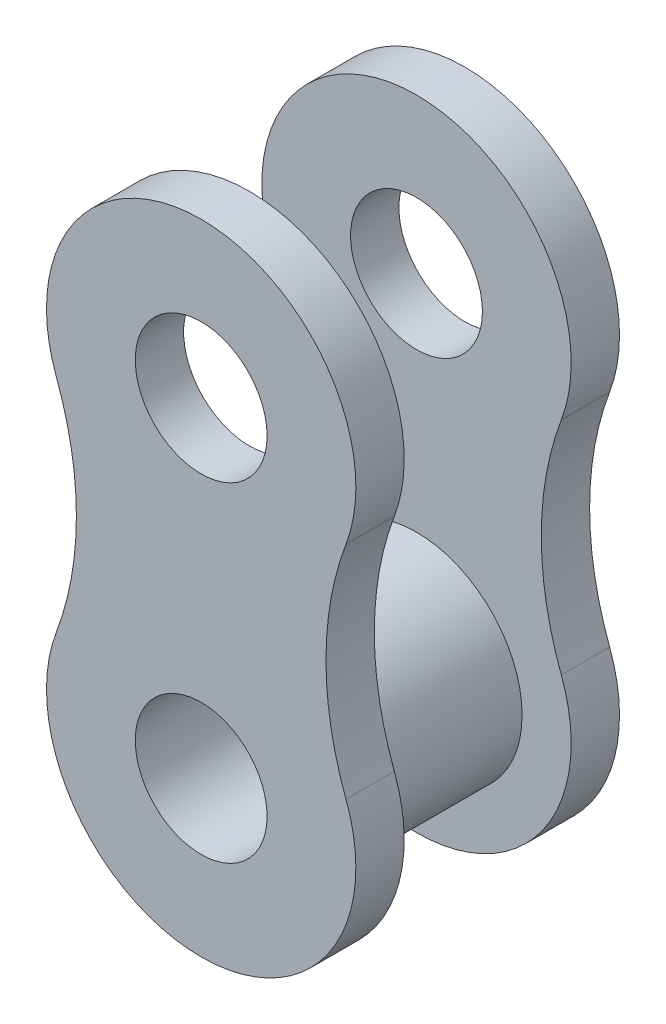
from build123d import *

# Parameters (mm, degrees)
SKETCH2_R           = 4.4704
SKETCH2_R_2         = 1.905
BOSS_EXTRUDE1_DEPTH = 1.397
SKETCH3_R           = 3.052127004
SKETCH3_R_2         = 1.905
BOSS_EXTRUDE2_DEPTH = 4.826


with BuildPart() as part:
    # Sketch2 → Boss-Extrude1 (new body)
    # profile 1 of 3: a face of its own
    with BuildSketch(Plane.XY):
        Circle(SKETCH2_R)
        Circle(SKETCH2_R_2, mode=Mode.SUBTRACT)
    # profile 2 of 3: a face of its own
    with BuildSketch(Plane.XY):
        with BuildLine():
            ThreePointArc((-4.185765955, 1.569662233), (0, 4.4704), (4.185765955, 1.569662233))
            ThreePointArc((4.185765955, 1.569662233), (3.606794054, 4.7625), (4.185765955, 7.955337767))
            ThreePointArc((4.185765955, 7.955337767), (0, 5.0546), (-4.185765955, 7.955337767))
            ThreePointArc((-4.185765955, 7.955337767), (-3.606794054, 4.7625), (-4.185765955, 1.569662233))
        make_face()
    # profile 3 of 3: a face of its own
    with BuildSketch(Plane.XY):
        with Locations((0, 9.525)):
            Circle(SKETCH2_R)
        with Locations((0, 9.525)):
            Circle(SKETCH2_R_2, mode=Mode.SUBTRACT)
    boss_extrude1 = extrude(amount=BOSS_EXTRUDE1_DEPTH)

    # Sketch3 → Boss-Extrude2 (add)
    with BuildSketch(Plane.XY.offset(1.397)):
        Circle(SKETCH3_R)
        Circle(SKETCH3_R_2, mode=Mode.SUBTRACT)
    extrude(amount=BOSS_EXTRUDE2_DEPTH)

    # Mirror1: Boss-Extrude1 across plane
    add(boss_extrude1.mirror(Plane.XY.offset(3.81)))


solid = part.part
